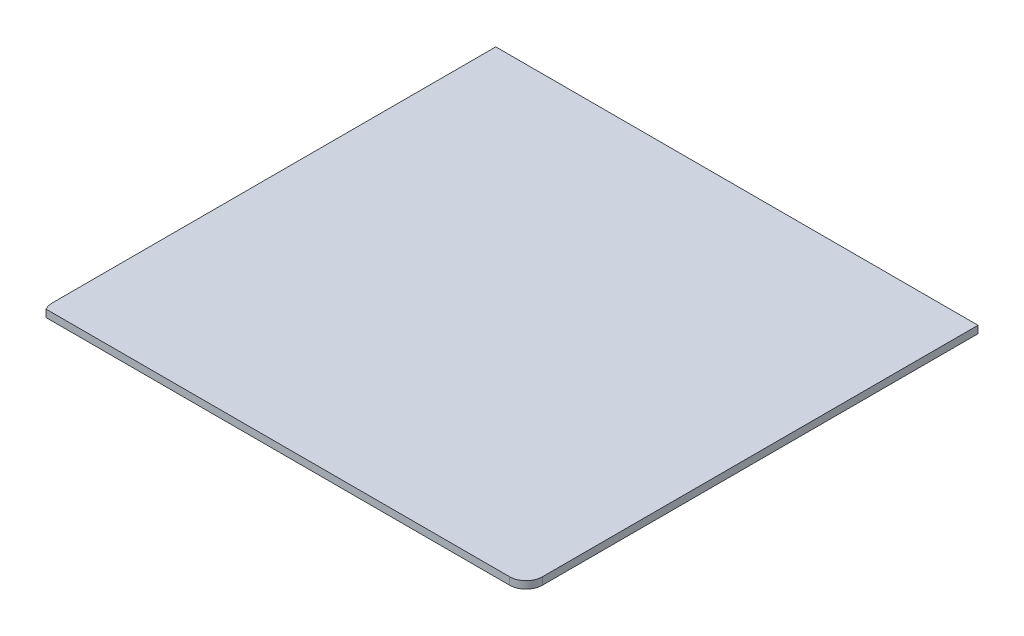
from build123d import *

# Parameters (mm, degrees)
SKETCH_1_W          = 118
SKETCH_1_H          = 110.6
EXTRUDE_1_DEPTH     = 1.8
CUT_EXTRUDE_1_DEPTH = 86.725227637
FILLET_1_R          = 4


with BuildPart() as part:
    # Эскиз1 → Бобышка-Вытянуть1 (new body)
    with BuildSketch(Plane(origin=(0, 0, 0), x_dir=(1, 0, 0), z_dir=(0, 1, 0))):
        with Locations((-2.290833333, -4.608333333)):
            Rectangle(SKETCH_1_W, SKETCH_1_H)
    extrude(amount=EXTRUDE_1_DEPTH)

    # Эскиз2 → Вырез-Вытянуть1 (cut, through all)
    with BuildSketch(Plane(origin=(0, 1.8, 0), x_dir=(1, 0, 0), z_dir=(0, 1, 0))):
        Polygon((-60.751506463, -59.916396196), (-61.297229463, -59.916396196), (-61.290819216, -57.908253599), (-61.253093448, -58.202342018), (-61.222338592, -58.4420892), (-61.167479406, -58.845558834), (-61.154637964, -58.943098844), (-61.150921997, -58.952139891), (-61.128591446, -59.006470711), (-61.069391255, -59.150506338), (-60.907702538, -59.543899251), align=None)
    extrude(amount=-CUT_EXTRUDE_1_DEPTH, mode=Mode.SUBTRACT)

    # Скругление1
    fillet_1_edges = [part.edges().sort_by_distance(p)[0] for p in [
        (56.709166667, 0.9, 59.908333333),
    ]]
    fillet(fillet_1_edges, radius=FILLET_1_R)


solid = part.part
